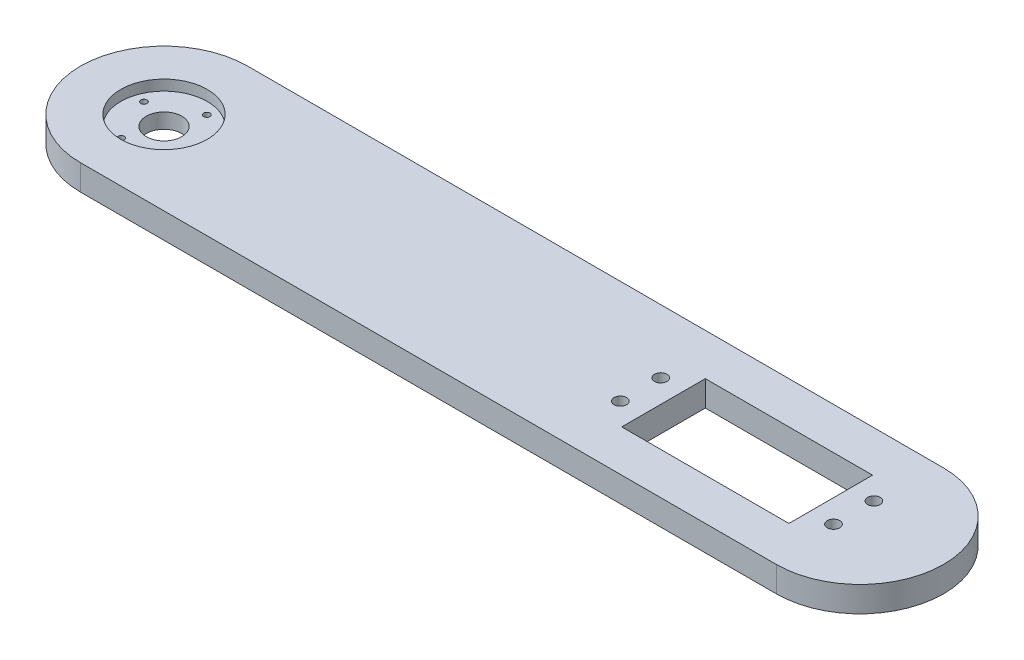
from build123d import *

# Parameters (mm, degrees)
SKETCH1_R           = 4.25
SKETCH1_R_2         = 1.5
SKETCH1_W           = 40
SKETCH1_H           = 20
BOSS_EXTRUDE1_DEPTH = 6.1
SKETCH2_R           = 10.35
CUT_EXTRUDE1_DEPTH  = 2.5
SKETCH3_R           = 0.75
CUT_EXTRUDE3_DEPTH  = 3.6


with BuildPart() as part:
    # Sketch1 → Boss-Extrude1 (new body)
    with BuildSketch(Plane(origin=(0, 0, 0), x_dir=(1, 0, 0), z_dir=(0, 1, 0))):
        with BuildLine():
            Line((150, 20), (159.5, 20))
            Line((159.5, 20), (166.5, 20))
            ThreePointArc((166.5, 20), (186.5, 0), (166.5, -20))
            Line((166.5, -20), (159.5, -20))
            Line((159.5, -20), (150, -20))
            Line((150, -20), (0, -20))
            ThreePointArc((0, -20), (-20, 0), (0, 20))
            Line((0, 20), (150, 20))
        make_face()
        with Locations(Location((0, 0, 0), (0, 0, 270))):
            Circle(SKETCH1_R, mode=Mode.SUBTRACT)
        with Locations(Location((165, 4.825, 0), (0, 0, 270))):
            Circle(SKETCH1_R_2, mode=Mode.SUBTRACT)
        with Locations(Location((165, -4.825, 0), (0, 0, 270))):
            Circle(SKETCH1_R_2, mode=Mode.SUBTRACT)
        with Locations(Location((114, 4.825, 0), (0, 0, 270))):
            Circle(SKETCH1_R_2, mode=Mode.SUBTRACT)
        with Locations(Location((114, -4.825, 0), (0, 0, 270))):
            Circle(SKETCH1_R_2, mode=Mode.SUBTRACT)
        with Locations((139.5, 0)):
            Rectangle(SKETCH1_W, SKETCH1_H, mode=Mode.SUBTRACT)
    extrude(amount=BOSS_EXTRUDE1_DEPTH)

    # Sketch2 → Cut-Extrude1 (cut)
    with BuildSketch(Plane(origin=(0, 6.1, 0), x_dir=(1, 0, 0), z_dir=(0, 1, 0))):
        with Locations(Location((0, 0, 0), (0, 0, 270))):
            Circle(SKETCH2_R)
    extrude(amount=-CUT_EXTRUDE1_DEPTH, mode=Mode.SUBTRACT)

    # Sketch3 → Cut-Extrude3 (cut)
    with BuildSketch(Plane(origin=(0, 3.6, 0), x_dir=(1, 0, 0), z_dir=(0, 1, 0))):
        with Locations(Location((-7.52500865, 2.715556079, 0), (0, 0, 270))):
            Circle(SKETCH3_R)
        with Locations(Location((7.52500865, -2.715556079, 0), (0, 0, 270))):
            Circle(SKETCH3_R)
        with Locations(Location((2.715556079, 7.52500865, 0), (0, 0, 270))):
            Circle(SKETCH3_R)
        with Locations(Location((-2.715556079, -7.52500865, 0), (0, 0, 270))):
            Circle(SKETCH3_R)
    extrude(amount=-CUT_EXTRUDE3_DEPTH, mode=Mode.SUBTRACT)


solid = part.part
